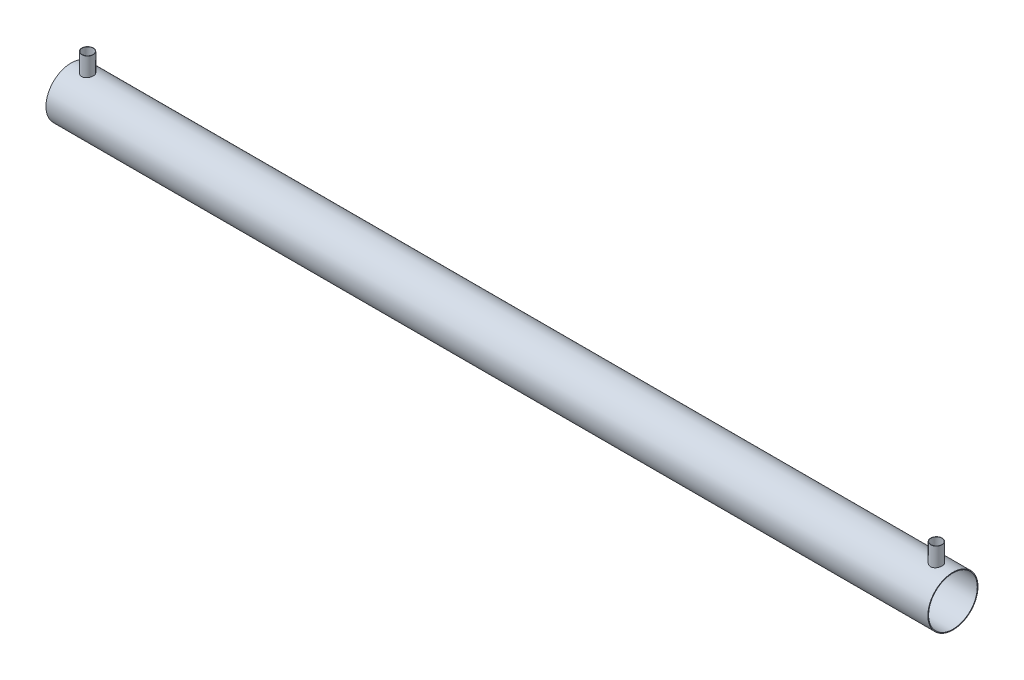
from build123d import *

# Parameters (mm, degrees)
SKETCH1_R                = 173.275
SKETCH1_R_2              = 168.275
BOSS_EXTRUDE1_DEPTH      = 6096
BOSS_EXTRUDE2_REACH      = 6118.82
BOSS_EXTRUDE2_END_RADIUS = 173.275
SKETCH3_R                = 40.1
CUT_EXTRUDE1_REACH       = 6118.82
CUT_EXTRUDE1_END_RADIUS  = 168.275
SKETCH4_R                = 38.1


with BuildPart() as part:
    # Sketch1 → Boss-Extrude1 (new body)
    with BuildSketch(Plane(origin=(0, 0, 0), x_dir=(0, 0, -1), z_dir=(1, 0, 0))):
        Circle(SKETCH1_R)
        Circle(SKETCH1_R_2, mode=Mode.SUBTRACT)
    extrude(amount=BOSS_EXTRUDE1_DEPTH)

    # Boss-Extrude2: up to this cylinder (the profile starts outside it)
    boss_extrude2_end = Plane(origin=(3048, 0, 0), z_dir=(-1, 0, 0)) * Cylinder(BOSS_EXTRUDE2_END_RADIUS, 18452.59, mode=Mode.PRIVATE)
    # Sketch3 → Boss-Extrude2 (add, up to the surface)
    with BuildSketch(Plane(origin=(0, 300.2750027, 0), x_dir=(1, 0, 0), z_dir=(0, 1, 0)), mode=Mode.PRIVATE) as boss_extrude2_sk1:
        with Locations(Location((114.3, 0, 0), (0, 0, 270))):
            Circle(SKETCH3_R)
    boss_extrude2_tool1 = extrude(boss_extrude2_sk1.sketch, amount=-BOSS_EXTRUDE2_REACH, mode=Mode.PRIVATE) - boss_extrude2_end
    add(boss_extrude2_tool1.solids().sort_by_distance((114.3, 300.275003, 0))[0])
    # Sketch3 → Boss-Extrude2 (add, up to the surface)
    with BuildSketch(Plane(origin=(0, 300.2750027, 0), x_dir=(1, 0, 0), z_dir=(0, 1, 0)), mode=Mode.PRIVATE) as boss_extrude2_sk2:
        with Locations(Location((5981.7, 0, 0), (0, 0, 270))):
            Circle(SKETCH3_R)
    boss_extrude2_tool2 = extrude(boss_extrude2_sk2.sketch, amount=-BOSS_EXTRUDE2_REACH, mode=Mode.PRIVATE) - boss_extrude2_end
    add(boss_extrude2_tool2.solids().sort_by_distance((5981.7, 300.275003, 0))[0])

    # Cut-Extrude1: up to this cylinder (the profile starts outside it)
    cut_extrude1_end = Plane(origin=(3048, 0, 0), z_dir=(-1, 0, 0)) * Cylinder(CUT_EXTRUDE1_END_RADIUS, 18442.59, mode=Mode.PRIVATE)
    # Sketch4 → Cut-Extrude1 (cut, up to the surface)
    with BuildSketch(Plane(origin=(0, 300.2750027, 0), x_dir=(1, 0, 0), z_dir=(0, 1, 0)), mode=Mode.PRIVATE) as cut_extrude1_sk1:
        with Locations(Location((114.3, 0, 0), (0, 0, 270))):
            Circle(SKETCH4_R)
    cut_extrude1_tool1 = extrude(cut_extrude1_sk1.sketch, amount=-CUT_EXTRUDE1_REACH, mode=Mode.PRIVATE) - cut_extrude1_end
    add(cut_extrude1_tool1.solids().sort_by_distance((114.3, 300.275003, 0))[0], mode=Mode.SUBTRACT)
    # Sketch4 → Cut-Extrude1 (cut, up to the surface)
    with BuildSketch(Plane(origin=(0, 300.2750027, 0), x_dir=(1, 0, 0), z_dir=(0, 1, 0)), mode=Mode.PRIVATE) as cut_extrude1_sk2:
        with Locations(Location((5981.7, 0, 0), (0, 0, 270))):
            Circle(SKETCH4_R)
    cut_extrude1_tool2 = extrude(cut_extrude1_sk2.sketch, amount=-CUT_EXTRUDE1_REACH, mode=Mode.PRIVATE) - cut_extrude1_end
    add(cut_extrude1_tool2.solids().sort_by_distance((5981.7, 300.275003, 0))[0], mode=Mode.SUBTRACT)


solid = part.part
